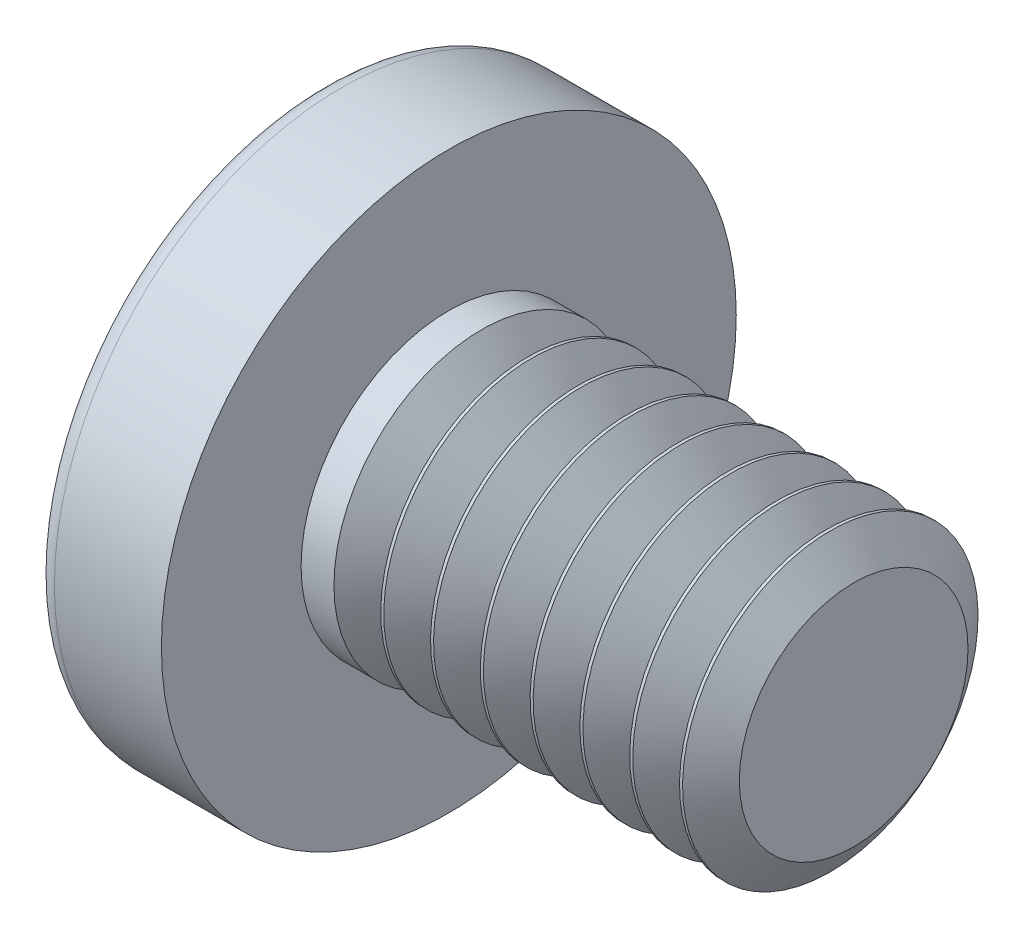
from build123d import *

# Parameters (mm, degrees)
CIRPATTERN1_COUNT = 2
CIRPATTERN1_ANGLE = 90
THDSCHPAT_COUNT   = 8
THDSCHPAT_PITCH   = 0.31242


with BuildPart() as part:
    # BodySke → Base-Revolve (revolve)
    with BuildSketch(Plane.XY, mode=Mode.PRIVATE) as base_revolve_sk:
        with BuildLine():
            Line((1.3462, 0.9271), (1.3462, 1.8034))
            Line((1.3462, 1.8034), (0.674626477, 1.8034))
            ThreePointArc((0.674626477, 1.8034), (0.617148621, 1.789648824), (0.572117822, 1.751373166))
            ThreePointArc((0.572117822, 1.751373166), (0.146654244, 0.921225647), (0, 0))
            Line((0, 0), (3.8862, 0))
            Line((3.8862, 0), (3.8862, 0.9271))
            Line((3.8862, 0.9271), (1.3462, 0.9271))
        make_face()
    revolve(base_revolve_sk.sketch.rotate(Axis((-25.4, 0, 0), (1, 0, 0)), 90), axis=Axis((-25.4, 0, 0), (1, 0, 0)))

    # Sketch3 → Cut-Loft1 section 0
    with BuildSketch(Plane(origin=(0, 0, 0), x_dir=(0, 0, -1), z_dir=(1, 0, 0))):
        with BuildLine():
            Line((0.3048, -1.1303), (-0.3048, -1.1303))
            Line((-0.3048, -1.1303), (-0.3048, 1.1303))
            Line((-0.3048, 1.1303), (0.3048, 1.1303))
            Line((0.3048, 1.1303), (0.3048, -1.1303))
        make_face()
    # Sketch4 → Cut-Loft1 section 1
    with BuildSketch(Plane(origin=(1.1684, 0, 0), x_dir=(0, 0, -1), z_dir=(1, 0, 0))):
        with BuildLine():
            Line((0.1524, -0.1524), (-0.1524, -0.1524))
            Line((-0.1524, -0.1524), (-0.1524, 0.1524))
            Line((-0.1524, 0.1524), (0.1524, 0.1524))
            Line((0.1524, 0.1524), (0.1524, -0.1524))
        make_face()
    cut_loft1 = loft(mode=Mode.SUBTRACT)

    # CirPattern1: Cut-Loft1 ×2 about axis
    cirpattern1_axis = Axis((0, 0, 0), (1, 0, 0))
    for i in range(1, CIRPATTERN1_COUNT):
        add(cut_loft1.rotate(cirpattern1_axis, i * CIRPATTERN1_ANGLE / (CIRPATTERN1_COUNT - 1)), mode=Mode.SUBTRACT)

    # ThdSchSke → ThreadSchematic (revolve, cut)
    with BuildSketch(Plane.XY, mode=Mode.PRIVATE) as threadschematic_sk:
        Polygon((1.69926, -0.71755), (1.55253151, -0.9271), (1.55253151, -1.158875), (1.84598849, -1.158875), (1.84598849, -0.9271), align=None)
    threadschematic = revolve(threadschematic_sk.sketch.rotate(Axis((-3.175, 0, 0), (1, 0, 0)), 270), axis=Axis((-3.175, 0, 0), (1, 0, 0)), mode=Mode.SUBTRACT)

    # ThdSchPat: ThreadSchematic ×8
    with Locations(*[(i * THDSCHPAT_PITCH, 0, 0) for i in range(1, THDSCHPAT_COUNT)]):
        add(threadschematic, mode=Mode.SUBTRACT)


solid = part.part
